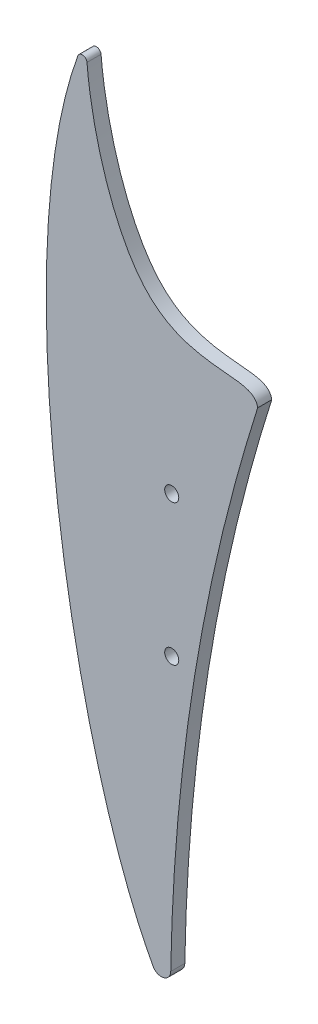
from build123d import *

# Parameters (mm, degrees)
SKETCH1_R           = 1.5
BOSS_EXTRUDE1_DEPTH = 3
FILLET1_R           = 1
FILLET2_R           = 2


with BuildPart() as part:
    # Sketch1 → Boss-Extrude1 (new body)
    with BuildSketch(Plane.XY):
        with BuildLine():
            add(Edge.make_bspline(
                [(0, 0), (0.039034334, 61.604929497), (18.579234973, 120)],
                knots=[0, 0, 0, 1, 1, 1], degree=2))
            add(Edge.make_bspline(
                [(-18.032786885, 170), (-17.742349194, 156.285056374), (-6.538751715, 115.023114242), (17.720626912, 125.598656039), (18.579234973, 120)],
                knots=[0, 0, 0, 0, 0.447403359, 1, 1, 1, 1], degree=3))
            add(Edge.make_bspline(
                [(0, 0), (-19.47734459, 25.868323257), (-37.629056536, 125.986890488), (-18.032786885, 170)],
                knots=[0, 0, 0, 0, 1, 1, 1, 1], degree=3))
        make_face()
        with Locations((0.270016121, 65)):
            Circle(SKETCH1_R, mode=Mode.SUBTRACT)
        with Locations((0.270016121, 95)):
            Circle(SKETCH1_R, mode=Mode.SUBTRACT)
    extrude(amount=BOSS_EXTRUDE1_DEPTH)

    # Fillet1
    fillet1_edges = [part.edges().sort_by_distance(p)[0] for p in [
        (-18.032786885, 170, 1.5),
    ]]
    fillet(fillet1_edges, radius=FILLET1_R)

    # Fillet2
    fillet2_edges = [part.edges().sort_by_distance(p)[0] for p in [
        (0, 0, 1.5),
    ]]
    fillet(fillet2_edges, radius=FILLET2_R)


solid = part.part
